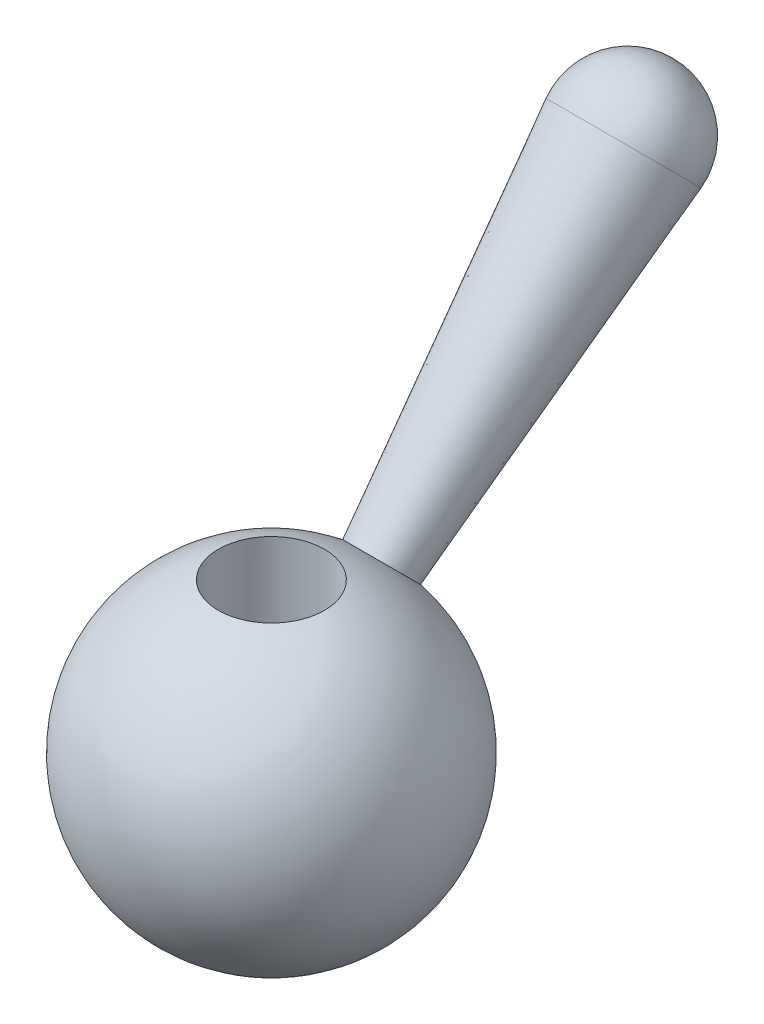
from build123d import *

# Parameters (mm, degrees)
CUT_EXTRUDE_1_DEPTH      = 52.961524227
CUT_EXTRUDE_1_DEPTH_BACK = 52.961524227
SKETCH_2_R               = 10


with BuildPart() as part:
    # 草图1 → 旋转1 (revolve)
    with BuildSketch(Plane.XY):
        with BuildLine():
            Line((0, 30), (0, -30))
            ThreePointArc((0, -30), (30, 0), (0, 30))
        make_face()
    revolve(axis=Axis((0, 30, 0), (0, -1, 0)))

    # 草图2 → 切除-拉伸1 (cut, two sides: drawn at the far end of the back side and taken through both)
    with BuildSketch(Plane(origin=(0, 0, 0), x_dir=(1, 0, 0), z_dir=(0, 1, 0)).offset(-CUT_EXTRUDE_1_DEPTH_BACK)):
        Circle(SKETCH_2_R)
    extrude(amount=CUT_EXTRUDE_1_DEPTH + CUT_EXTRUDE_1_DEPTH_BACK, mode=Mode.SUBTRACT)

    # 草图4 → 旋转10 (revolve)
    with BuildSketch(Plane(origin=(0, 0, 0), x_dir=(0, 0, -1), z_dir=(1, 0, 0))):
        with BuildLine():
            Line((20.784609691, 20.784609691), (25.027250378, 16.541969004))
            Line((25.027250378, 16.541969004), (74.845263688, 57.946424516))
            ThreePointArc((74.845263688, 57.946424516), (79.16245845, 66.623512664), (75.660425587, 75.660425587))
            Line((75.660425587, 75.660425587), (20.784609691, 20.784609691))
        make_face()
    revolve(axis=Axis((0, 20.784609691, -20.784609691), (0, 0.7071067811865493, -0.7071067811865458)))


solid = part.part
